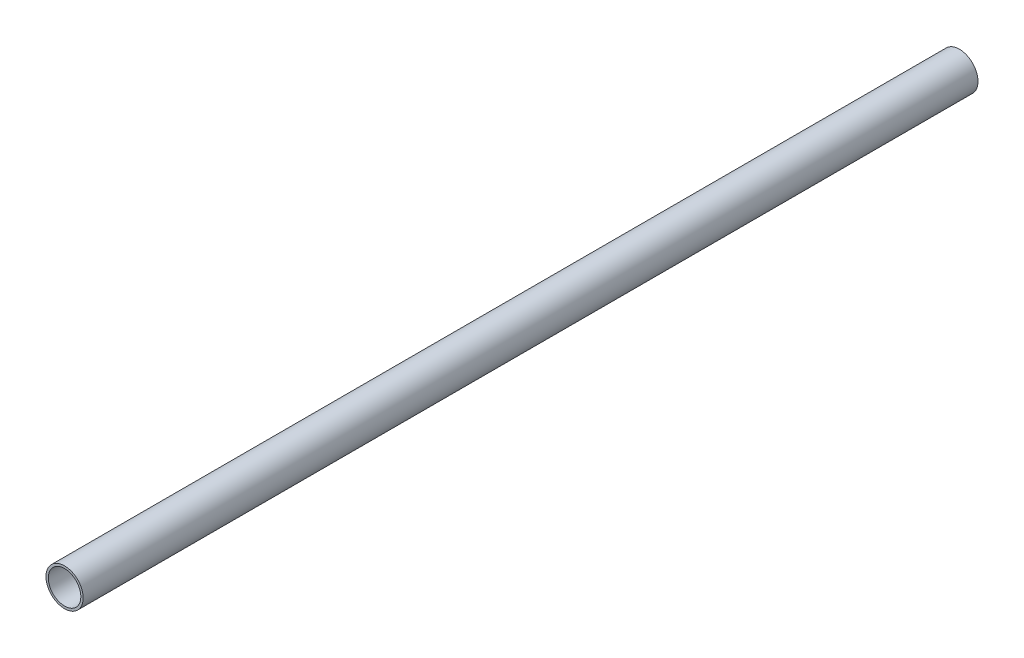
from build123d import *

# Parameters (mm, degrees)
SKETCH_1_R      = 8
SKETCH_1_R_2    = 7
EXTRUDE_1_DEPTH = 192.5


with BuildPart() as part:
    # 草图1 → 凸台-拉伸1 (new, symmetric)
    with BuildSketch(Plane.XY):
        Circle(SKETCH_1_R)
        Circle(SKETCH_1_R_2, mode=Mode.SUBTRACT)
    extrude(amount=EXTRUDE_1_DEPTH, both=True)


solid = part.part
